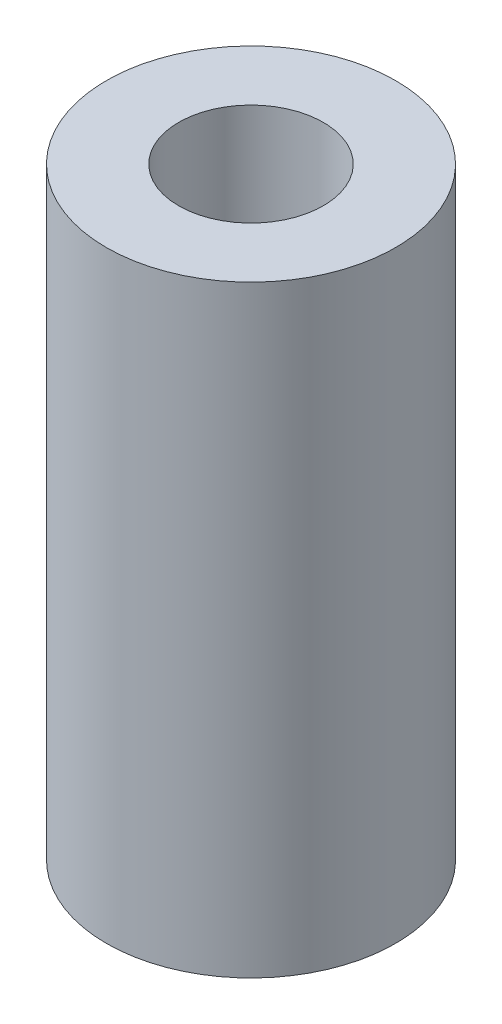
from build123d import *

# Parameters (mm, degrees)
SKETCH1_R           = 6
SKETCH1_R_2         = 3
BOSS_EXTRUDE1_DEPTH = 25


with BuildPart() as part:
    # Sketch1 → Boss-Extrude1 (new body)
    with BuildSketch(Plane(origin=(0, 0, 0), x_dir=(1, 0, 0), z_dir=(0, 1, 0))):
        with Locations(Location((0, 0, 0), (0, 0, 270))):
            Circle(SKETCH1_R)
        with Locations(Location((0, 0, 0), (0, 0, 270))):
            Circle(SKETCH1_R_2, mode=Mode.SUBTRACT)
    extrude(amount=BOSS_EXTRUDE1_DEPTH)


solid = part.part
